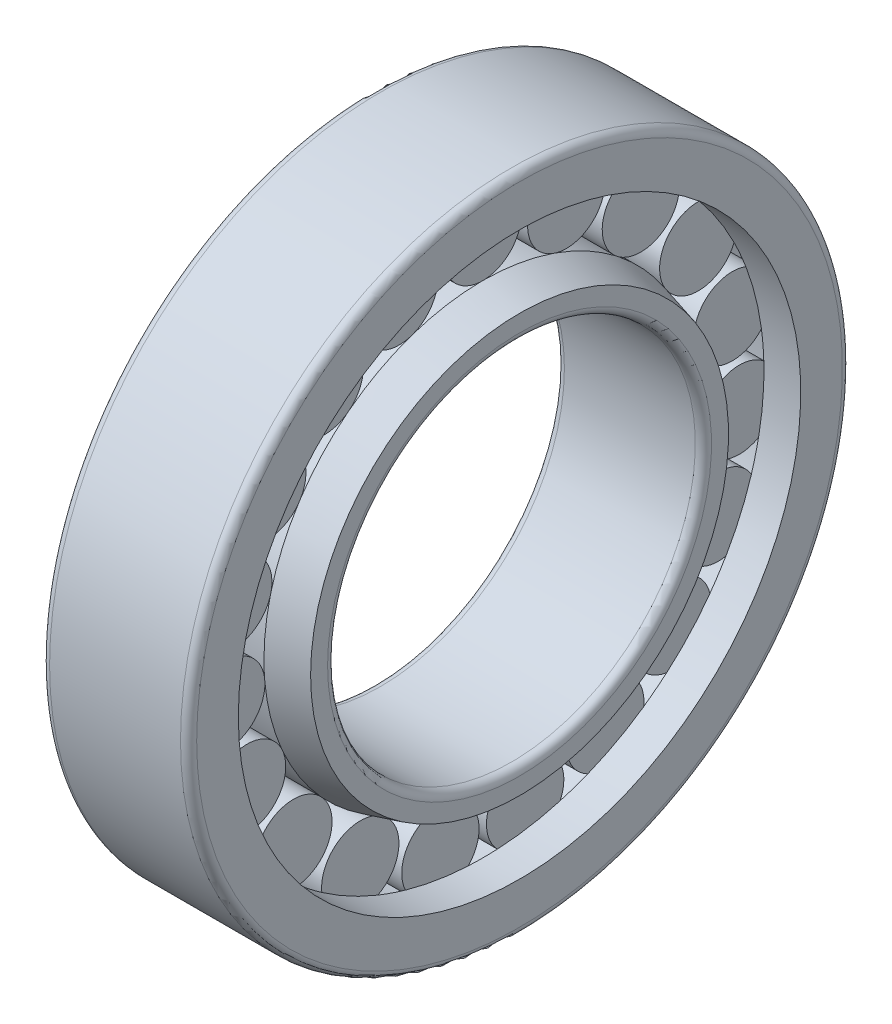
from build123d import *

# Parameters (mm, degrees)
SKETCH2_W               = 10
SKETCH2_H               = 5.26
CIRCULAR_PATTERN1_COUNT = 19
FILLET1_R               = 1.1
FILLET2_R               = 1.1


with BuildPart() as part:
    # Sketch1 → Revolve1 (revolve)
    with BuildSketch(Plane.XY, mode=Mode.PRIVATE) as revolve1_sk:
        Polygon((-10, 25), (10, 25), (10, 28.410254038), (5, 29.75), (-5, 29.75), (-10, 28.410254038), align=None)
    revolve(revolve1_sk.sketch.rotate(Axis((-10.137871204, 0, 0), (1, 0, 0)), 90), axis=Axis((-10.137871204, 0, 0), (1, 0, 0)))

    # Sketch2 → Revolve2 (revolve)
    with BuildSketch(Plane.XY):
        with Locations((0, 32.37)):
            Rectangle(SKETCH2_W, SKETCH2_H)
    revolve2 = revolve(axis=Axis((-7.422783257, 35, 0), (1, 0, 0)))

    # Sketch3 → Revolve3 (revolve)
    with BuildSketch(Plane.XY, mode=Mode.PRIVATE) as revolve3_sk:
        Polygon((-10, 45), (10, 45), (10, 38.2375), (4.99, 38.2375), (4.99, 40.25), (-4.99, 40.25), (-4.99, 38.2375), (-10, 38.2375), align=None)
    revolve(revolve3_sk.sketch.rotate(Axis((-9.082213196, 0, 0), (1, 0, 0)), 90), axis=Axis((-9.082213196, 0, 0), (1, 0, 0)))

    # Circular-Pattern1: Revolve2 ×19 about axis
    circular_pattern1_axis = Axis((0, 0, 0), (1, 0, 0))
    for i in range(1, CIRCULAR_PATTERN1_COUNT):
        add(revolve2.rotate(circular_pattern1_axis, i * 360 / CIRCULAR_PATTERN1_COUNT))

    # Fillet1
    fillet1_edges = [part.edges().sort_by_distance(p)[0] for p in [
        (-10, 0, -45),
        (10, 0, -45),
    ]]
    fillet(fillet1_edges, radius=FILLET1_R)

    # Fillet2
    fillet2_edges = [part.edges().sort_by_distance(p)[0] for p in [
        (10, 0, -25),
        (-10, 0, -25),
    ]]
    fillet(fillet2_edges, radius=FILLET2_R)


solid = part.part
